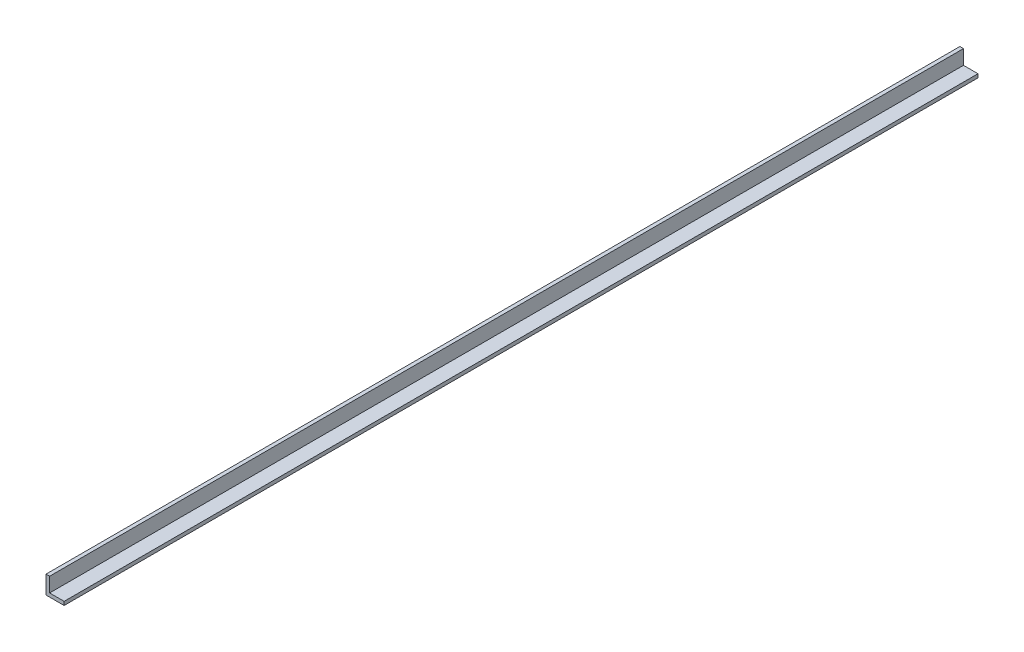
from build123d import *

# Parameters (mm, degrees)
EXTRUDE_1_DEPTH = 1008


with BuildPart() as part:
    # Эскиз1 → Бобышка-Вытянуть1 (new body)
    with BuildSketch(Plane.XY):
        Polygon((-10, 20), (-10, 0), (10, 0), (10, 4), (-6, 4), (-6, 20), align=None)
    extrude(amount=EXTRUDE_1_DEPTH)


solid = part.part
